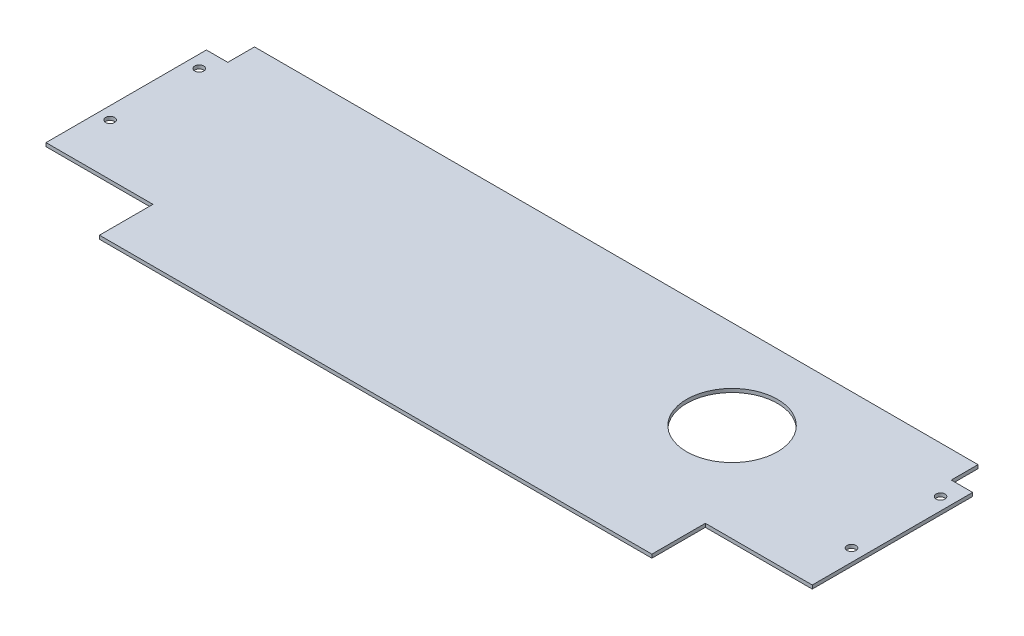
from build123d import *

# Parameters (mm, degrees)
SKETCH_2_W          = 430
SKETCH_2_H          = 135
EXTRUDE_1_DEPTH     = 2
SKETCH_3_R          = 2.5
SKETCH_3_W          = 12
SKETCH_3_H          = 15
SKETCH_3_W_2        = 60
SKETCH_3_H_2        = 30
CUT_EXTRUDE_1_DEPTH = 451.698347013
SKETCH_4_R          = 25.5
CUT_EXTRUDE_2_DEPTH = 451.698347013


with BuildPart() as part:
    # Эскиз2 → Бобышка-Вытянуть1 (new body)
    with BuildSketch(Plane(origin=(0, 0, 0), x_dir=(1, 0, 0), z_dir=(0, 1, 0))):
        with Locations((215, 67.5)):
            Rectangle(SKETCH_2_W, SKETCH_2_H)
    extrude(amount=EXTRUDE_1_DEPTH)

    # Эскиз3 → Вырез-Вытянуть1 (cut, through all)
    with BuildSketch(Plane(origin=(0, 2, 0), x_dir=(1, 0, 0), z_dir=(0, 1, 0))):
        with Locations(Location((7, 109, 0), (0, 0, 270))):
            Circle(SKETCH_3_R)
        with Locations(Location((423, 109, 0), (0, 0, 90))):
            Circle(SKETCH_3_R)
        with Locations(Location((7, 59, 0), (0, 0, 270))):
            Circle(SKETCH_3_R)
        with Locations(Location((423, 59, 0), (0, 0, 90))):
            Circle(SKETCH_3_R)
        with Locations((424, 127.5)):
            Rectangle(SKETCH_3_W, SKETCH_3_H)
        with Locations((6, 127.5)):
            Rectangle(SKETCH_3_W, SKETCH_3_H)
        with Locations((400, 15)):
            Rectangle(SKETCH_3_W_2, SKETCH_3_H_2)
        with Locations((30, 15)):
            Rectangle(SKETCH_3_W_2, SKETCH_3_H_2)
    extrude(amount=-CUT_EXTRUDE_1_DEPTH, mode=Mode.SUBTRACT)

    # Эскиз4 → Вырез-Вытянуть2 (cut, through all)
    with BuildSketch(Plane(origin=(0, 2, 0), x_dir=(1, 0, 0), z_dir=(0, 1, 0))):
        with Locations(Location((330, 85, 0), (0, 0, 270))):
            Circle(SKETCH_4_R)
    extrude(amount=-CUT_EXTRUDE_2_DEPTH, mode=Mode.SUBTRACT)


solid = part.part
